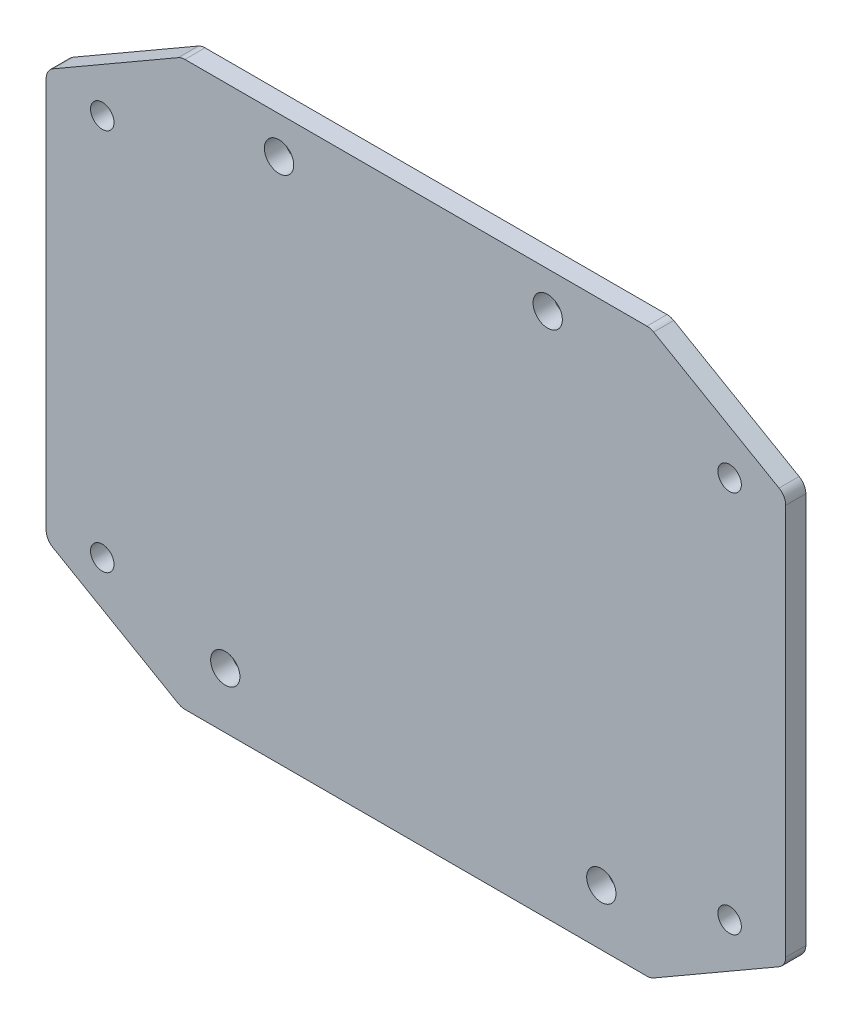
from build123d import *

# Parameters (mm, degrees)
EXTRUDE_1_DEPTH     = 3
EXTRUDE_START       = -3
EXTRUDE_2_DEPTH     = 3
EXTRUDE_3_DEPTH     = 3
SKETCH_4_R          = 2.187098749
CUT_EXTRUDE_1_DEPTH = 10
SKETCH_5_R          = 1.75
CUT_EXTRUDE_2_DEPTH = 10


with BuildPart() as part:
    # 草图1 → 凸台-拉伸1 (new body)
    with BuildSketch(Plane.XY):
        with BuildLine():
            Line((-34.464101615, 23.287401575), (34.464101615, 23.287401575))
            ThreePointArc((34.464101615, 23.287401575), (34.981739705, 23.219253227), (35.464101615, 23.019452382))
            Line((35.464101615, 23.019452382), (54.167481352, 12.221051057))
            ThreePointArc((54.167481352, 12.221051057), (54.899532159, 11.489000249), (55.167481352, 10.489000249))
            Line((55.167481352, 10.489000249), (55.167481352, -10.489000249))
            ThreePointArc((55.167481352, -10.489000249), (54.899532159, -11.489000249), (54.167481352, -12.221051057))
            Line((54.167481352, -12.221051057), (35.464101615, -23.019452382))
            ThreePointArc((35.464101615, -23.019452382), (34.981739705, -23.219253227), (34.464101615, -23.287401575))
            Line((34.464101615, -23.287401575), (-34.464101615, -23.287401575))
            ThreePointArc((-34.464101615, -23.287401575), (-34.981739705, -23.219253227), (-35.464101615, -23.019452382))
            Line((-35.464101615, -23.019452382), (-54.167481352, -12.221051057))
            ThreePointArc((-54.167481352, -12.221051057), (-54.899532159, -11.489000249), (-55.167481352, -10.489000249))
            Line((-55.167481352, -10.489000249), (-55.167481352, 10.489000249))
            ThreePointArc((-55.167481352, 10.489000249), (-54.899532159, 11.489000249), (-54.167481352, 12.221051057))
            Line((-54.167481352, 12.221051057), (-35.464101615, 23.019452382))
            ThreePointArc((-35.464101615, 23.019452382), (-34.981739705, 23.219253227), (-34.464101615, 23.287401575))
        make_face()
    extrude(amount=EXTRUDE_1_DEPTH)

    # 草图2 → 凸台-拉伸2 (add)
    with BuildSketch(Plane.XY.offset(3).offset(EXTRUDE_START)):
        with BuildLine():
            Line((-55.167481352, 15.551379934), (-55.167481352, 10.489000249))
            Line((-55.167481352, 10.489000249), (-55.167481352, -10.489000249))
            ThreePointArc((-55.167481352, -10.489000249), (-54.899532159, -11.489000249), (-54.167481352, -12.221051057))
            Line((-54.167481352, -12.221051057), (-35.464101615, -23.019452382))
            ThreePointArc((-35.464101615, -23.019452382), (-34.981739705, -23.219253227), (-34.464101615, -23.287401575))
            Line((-34.464101615, -23.287401575), (34.464101615, -23.287401575))
            ThreePointArc((34.464101615, -23.287401575), (34.981739705, -23.219253227), (35.464101615, -23.019452382))
            Line((35.464101615, -23.019452382), (54.167481352, -12.221051057))
            ThreePointArc((54.167481352, -12.221051057), (54.899532159, -11.489000249), (55.167481352, -10.489000249))
            Line((55.167481352, -10.489000249), (55.167481352, 10.489000249))
            Line((55.167481352, 10.489000249), (55.167481352, 15.551379934))
            Line((55.167481352, 15.551379934), (55.167481352, 36.529380432))
            ThreePointArc((55.167481352, 36.529380432), (54.899532159, 37.529380432), (54.167481352, 38.26143124))
            Line((54.167481352, 38.26143124), (35.464101615, 49.059832565))
            ThreePointArc((35.464101615, 49.059832565), (34.981739705, 49.25963341), (34.464101615, 49.327781758))
            Line((34.464101615, 49.327781758), (-34.464101615, 49.327781758))
            ThreePointArc((-34.464101615, 49.327781758), (-34.981739705, 49.25963341), (-35.464101615, 49.059832565))
            Line((-35.464101615, 49.059832565), (-54.167481352, 38.26143124))
            ThreePointArc((-54.167481352, 38.26143124), (-54.899532159, 37.529380432), (-55.167481352, 36.529380432))
            Line((-55.167481352, 36.529380432), (-55.167481352, 15.551379934))
        make_face()
    extrude(amount=EXTRUDE_2_DEPTH)

    # 草图3 → 凸台-拉伸3 (add)
    with BuildSketch(Plane.XY.offset(3)):
        with BuildLine():
            Line((55.167481352, 33.186292179), (-55.167481352, 33.186292179))
            Line((-55.167481352, 33.186292179), (-55.167481352, 47.90257896))
            ThreePointArc((-55.167481352, 47.90257896), (-54.899532159, 48.90257896), (-54.167481352, 49.634629768))
            Line((-54.167481352, 49.634629768), (-35.464101615, 60.433031094))
            ThreePointArc((-35.464101615, 60.433031094), (-34.981739705, 60.632831939), (-34.464101615, 60.700980286))
            Line((-34.464101615, 60.700980286), (34.464101615, 60.700980286))
            ThreePointArc((34.464101615, 60.700980286), (34.981739705, 60.632831939), (35.464101615, 60.433031094))
            Line((35.464101615, 60.433031094), (54.167481352, 49.634629768))
            ThreePointArc((54.167481352, 49.634629768), (54.899532159, 48.90257896), (55.167481352, 47.90257896))
            Line((55.167481352, 47.90257896), (55.167481352, 33.186292179))
        make_face()
    extrude(amount=-EXTRUDE_3_DEPTH)

    # 草图4 → 切除-拉伸1 (cut)
    with BuildSketch(Plane.XY.offset(3)):
        with Locations((-20.424577197, 55.161880556)):
            Circle(SKETCH_4_R)
        with Locations((19.655486733, 55.22184421)):
            Circle(SKETCH_4_R)
        with Locations((27.658697285, -14.95988945)):
            Circle(SKETCH_4_R)
        with Locations((-28.447724115, -14.95988945)):
            Circle(SKETCH_4_R)
    extrude(amount=-CUT_EXTRUDE_1_DEPTH, mode=Mode.SUBTRACT)

    # 草图5 → 切除-拉伸2 (cut)
    with BuildSketch(Plane.XY.offset(3)):
        with Locations((46.798601885, 47.255616016)):
            Circle(SKETCH_5_R)
        with Locations((-46.798601885, 47.255616016)):
            Circle(SKETCH_5_R)
        with Locations((46.798601885, -9.842037304)):
            Circle(SKETCH_5_R)
        with Locations((-46.798601885, -9.842037304)):
            Circle(SKETCH_5_R)
    extrude(amount=-CUT_EXTRUDE_2_DEPTH, mode=Mode.SUBTRACT)


solid = part.part
